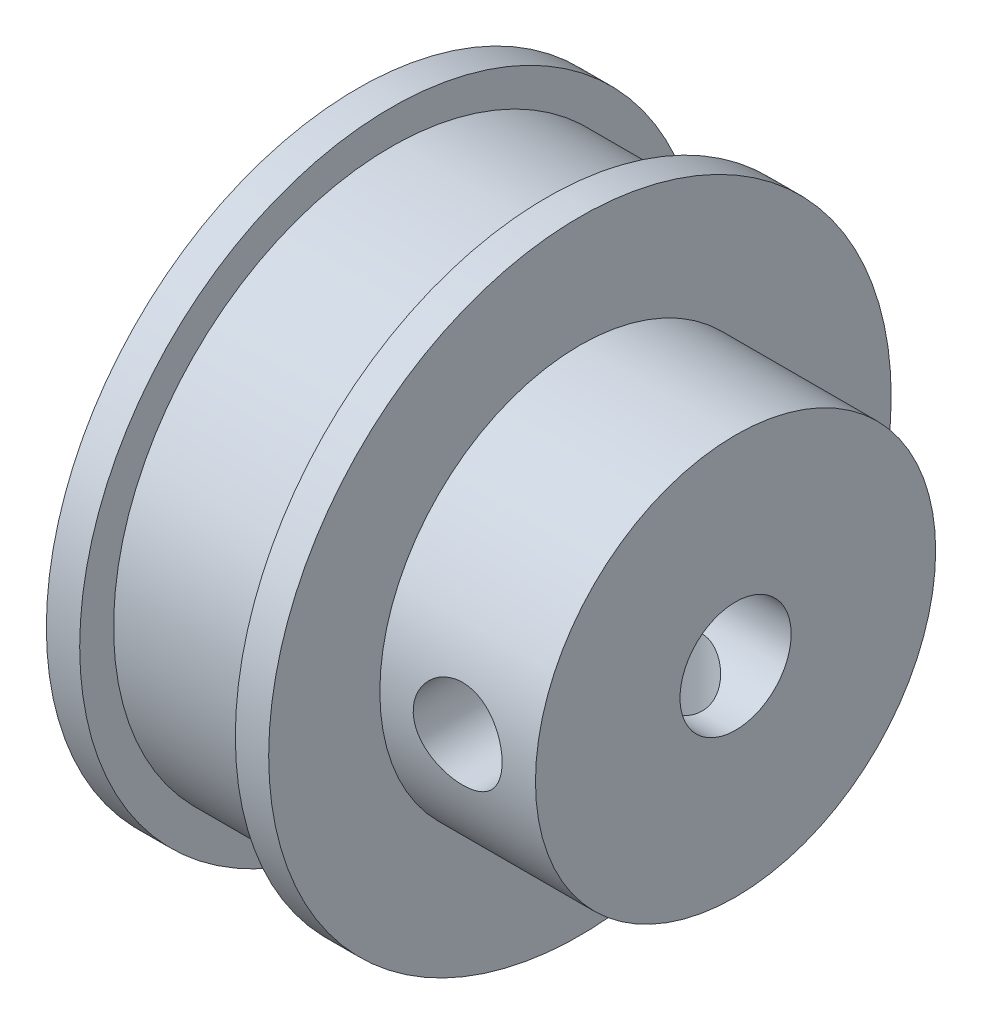
from build123d import *

# Parameters (mm, degrees)
CUT_EXTRUDE1_REACH      = 28.096
CUT_EXTRUDE1_END_RADIUS = 9
SKETCH2_R               = 2
CIRPATTERN1_COUNT       = 2
CIRPATTERN1_ANGLE       = 90


with BuildPart() as part:
    # Sketch1 → Revolve1 (revolve)
    with BuildSketch(Plane.XY, mode=Mode.PRIVATE) as revolve1_sk:
        Polygon((0, 2.5), (17, 2.5), (17, 9), (10, 9), (10, 14), (8.5, 14), (8.5, 12.475), (1.5, 12.475), (1.5, 14), (0, 14), align=None)
    revolve(revolve1_sk.sketch.rotate(Axis((17.85, 0, 0), (-1, 0, 0)), 90), axis=Axis((17.85, 0, 0), (-1, 0, 0)))

    # Cut-Extrude1: up to this cylinder (the profile starts inside it)
    cut_extrude1_end = Plane(origin=(13.5, 0, 0), z_dir=(1, 0, 0)) * Cylinder(CUT_EXTRUDE1_END_RADIUS, 75.192, mode=Mode.PRIVATE)
    # Sketch2 → Cut-Extrude1 (cut, up to the surface)
    with BuildSketch(Plane(origin=(0, 0, 0), x_dir=(1, 0, 0), z_dir=(0, 1, 0)), mode=Mode.PRIVATE) as cut_extrude1_sk1:
        with Locations(Location((13.5, 0, 0), (0, 0, 270))):
            Circle(SKETCH2_R)
    cut_extrude1_tool1 = extrude(cut_extrude1_sk1.sketch, amount=-CUT_EXTRUDE1_REACH, mode=Mode.PRIVATE) & cut_extrude1_end
    cut_extrude1 = cut_extrude1_tool1.solids().sort_by_distance((13.5, 0, 0))[0]
    add(cut_extrude1, mode=Mode.SUBTRACT)

    # CirPattern1: Cut-Extrude1 ×2 about axis
    cirpattern1_axis = Axis((17.85, 0, 0), (-1, 0, 0))
    for i in range(1, CIRPATTERN1_COUNT):
        add(cut_extrude1.rotate(cirpattern1_axis, i * CIRPATTERN1_ANGLE / (CIRPATTERN1_COUNT - 1)), mode=Mode.SUBTRACT)


solid = part.part
